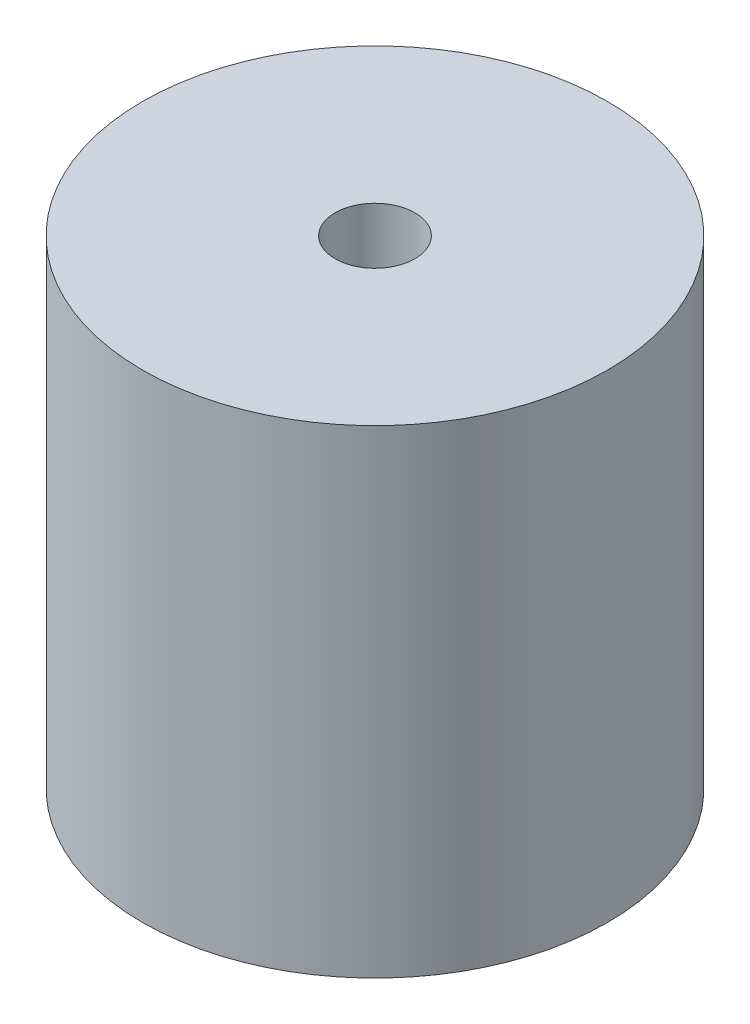
from build123d import *

# Parameters (mm, degrees)
ESQUISSE1_R             = 17.5
BOSS_EXTRU_1_DEPTH      = 36
ESQUISSE2_R             = 3
ENL_V_MAT_EXTRU_1_DEPTH = 44.686382318


with BuildPart() as part:
    # Esquisse1 → Boss.-Extru.1 (new body)
    with BuildSketch(Plane(origin=(0, 0, 0), x_dir=(1, 0, 0), z_dir=(0, 1, 0))):
        with Locations(Location((0, 0, 0), (0, 0, 270))):
            Circle(ESQUISSE1_R)
    extrude(amount=BOSS_EXTRU_1_DEPTH)

    # Esquisse2 → Enlèv. mat.-Extru.1 (cut, through all)
    with BuildSketch(Plane(origin=(0, 36, 0), x_dir=(1, 0, 0), z_dir=(0, 1, 0))):
        with Locations(Location((0, 0, 0), (0, 0, 270))):
            Circle(ESQUISSE2_R)
    extrude(amount=-ENL_V_MAT_EXTRU_1_DEPTH, mode=Mode.SUBTRACT)


solid = part.part
